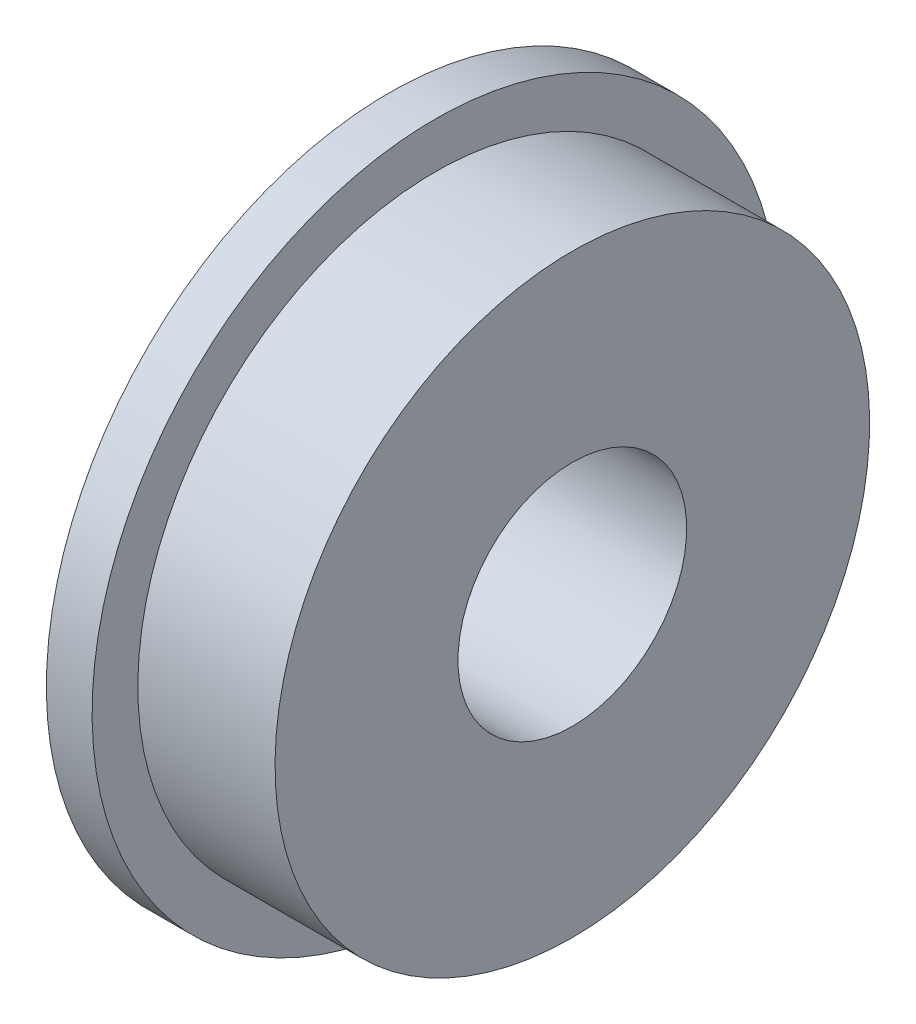
from build123d import *


with BuildPart() as part:
    # Model → 旋转1 (revolve)
    with BuildSketch(Plane.XY):
        Polygon((103.485844046, 23.320853375), (103.485844046, 19.320853375), (100.485844046, 19.320853375), (100.485844046, 18.320853375), (99.485844046, 18.320853375), (99.485844046, 22.820853375), (99.485844046, 23.320853375), align=None)
    revolve(axis=Axis((69.32894037, 25.820853375, 0), (1, 0, 0)))


solid = part.part
